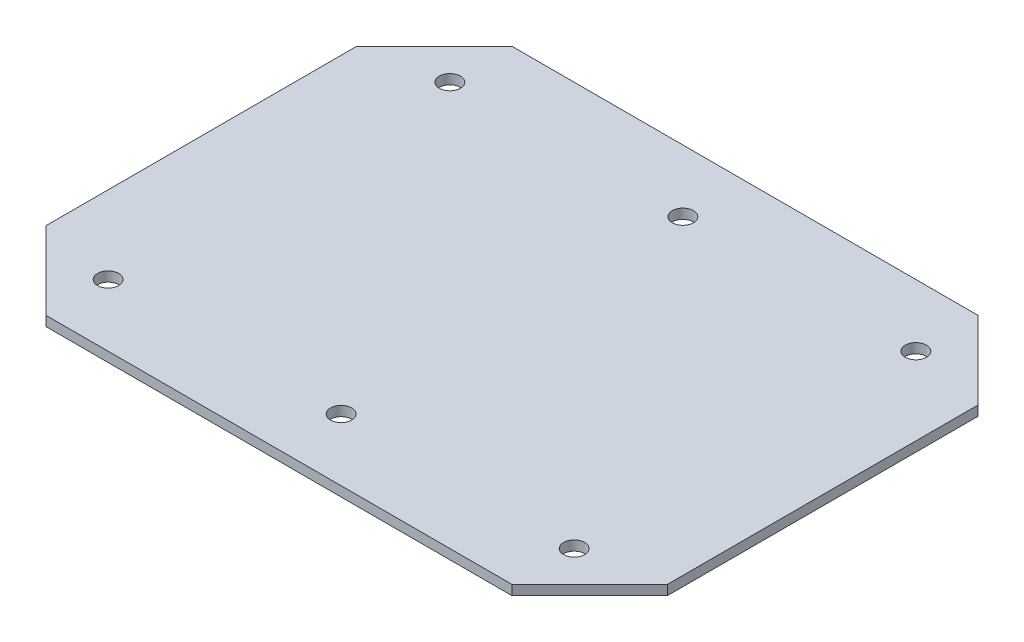
from build123d import *

# Parameters (mm, degrees)
SKETCH1_W             = 101.6
SKETCH1_H             = 76.2
BOSS_EXTRUDE1_DEPTH   = 1.600000102
F_4_CLEARANCE_HOLE1_D = 3.4544
CHAMFER1_SIZE         = 12.7


with BuildPart() as part:
    # Sketch1 → Boss-Extrude1 (new body)
    with BuildSketch(Plane(origin=(0, 0, 0), x_dir=(1, 0, 0), z_dir=(0, 1, 0))):
        Rectangle(SKETCH1_W, SKETCH1_H)
    extrude(amount=BOSS_EXTRUDE1_DEPTH)

    # #4 Clearance Hole1 (through all)
    with Locations(Plane(origin=(0, 1.600000102, 0), x_dir=(1, 0, 0), z_dir=(0, 1, 0))):
        with Locations((38.1, -27.94), (-38.1, -27.94), (0, -27.94), (38.1, 27.94), (0, 27.94), (-38.1, 27.94)):
            Hole(F_4_CLEARANCE_HOLE1_D / 2)

    # Chamfer1
    chamfer1_edges = [part.edges().sort_by_distance(p)[0] for p in [
        (-50.8, 0.800000051, -38.1),
        (50.8, 0.800000051, -38.1),
        (50.8, 0.800000051, 38.1),
        (-50.8, 0.800000051, 38.1),
    ]]
    chamfer(chamfer1_edges, length=CHAMFER1_SIZE)


solid = part.part
